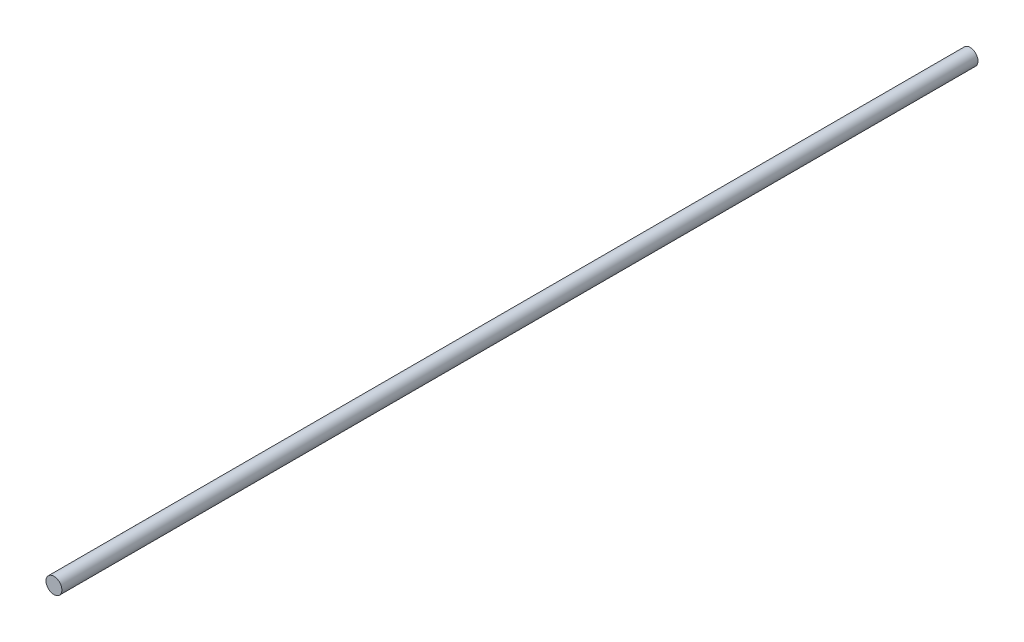
from build123d import *

# Parameters (mm, degrees)
SKETCH1_R           = 5
BOSS_EXTRUDE1_DEPTH = 576.6


with BuildPart() as part:
    # Sketch1 → Boss-Extrude1 (new body)
    with BuildSketch(Plane.XY):
        Circle(SKETCH1_R)
    extrude(amount=BOSS_EXTRUDE1_DEPTH)


solid = part.part
